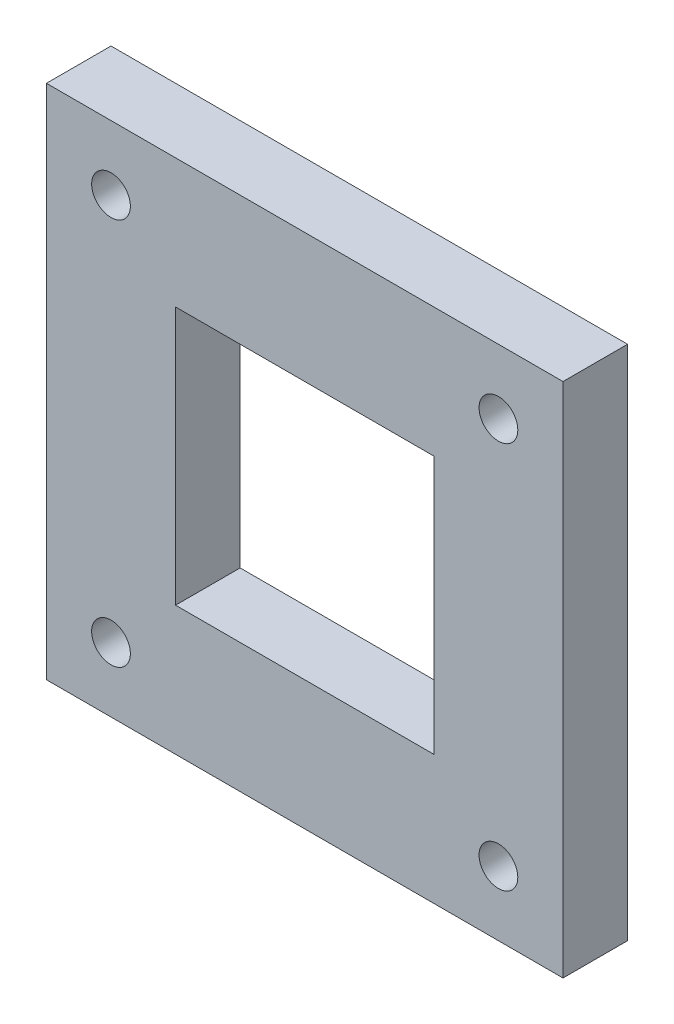
from build123d import *

# Parameters (mm, degrees)
RESSALTO_EXTRUS_O1_DEPTH = 5
ESBO_O2_R                = 1.5
ESBO_O2_W                = 20
ESBO_O2_H                = 20
CORTE_EXTRUS_O1_DEPTH    = 29.722813233


with BuildPart() as part:
    # Esboço1 → Ressalto-extrusão1 (new body)
    with BuildSketch(Plane.XY):
        Polygon((20, 0), (20, 20), (-20, 20), (-20, -20), (20, -20), align=None)
    extrude(amount=RESSALTO_EXTRUS_O1_DEPTH)

    # Esboço2 → Corte-extrusão1 (cut, through all)
    with BuildSketch(Plane.XY.offset(5)):
        with Locations((-15, 15)):
            Circle(ESBO_O2_R)
        with Locations((15, 15)):
            Circle(ESBO_O2_R)
        with Locations((-15, -15)):
            Circle(ESBO_O2_R)
        with Locations((15, -15)):
            Circle(ESBO_O2_R)
        Rectangle(ESBO_O2_W, ESBO_O2_H)
    extrude(amount=-CORTE_EXTRUS_O1_DEPTH, mode=Mode.SUBTRACT)


solid = part.part
